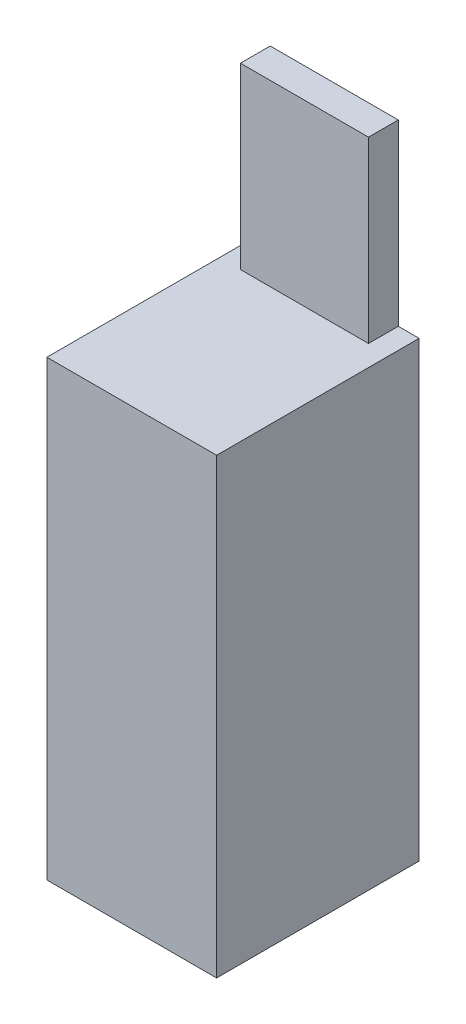
from build123d import *

# Parameters (mm, degrees)
SKETCH1_W           = 28.5
SKETCH1_H           = 34
BOSS_EXTRUDE1_DEPTH = 76
SKETCH2_W           = 21.5
SKETCH2_H           = 5
BOSS_EXTRUDE2_DEPTH = 30


with BuildPart() as part:
    # Sketch1 → Boss-Extrude1 (new body)
    with BuildSketch(Plane(origin=(0, 0, 0), x_dir=(1, 0, 0), z_dir=(0, 1, 0))):
        with Locations((14.25, 17)):
            Rectangle(SKETCH1_W, SKETCH1_H)
    extrude(amount=BOSS_EXTRUDE1_DEPTH)

    # Sketch2 → Boss-Extrude2 (add)
    with BuildSketch(Plane(origin=(0, 76, 0), x_dir=(1, 0, 0), z_dir=(0, 1, 0))):
        with Locations((14.25, 31.5)):
            Rectangle(SKETCH2_W, SKETCH2_H)
    extrude(amount=BOSS_EXTRUDE2_DEPTH)


solid = part.part
